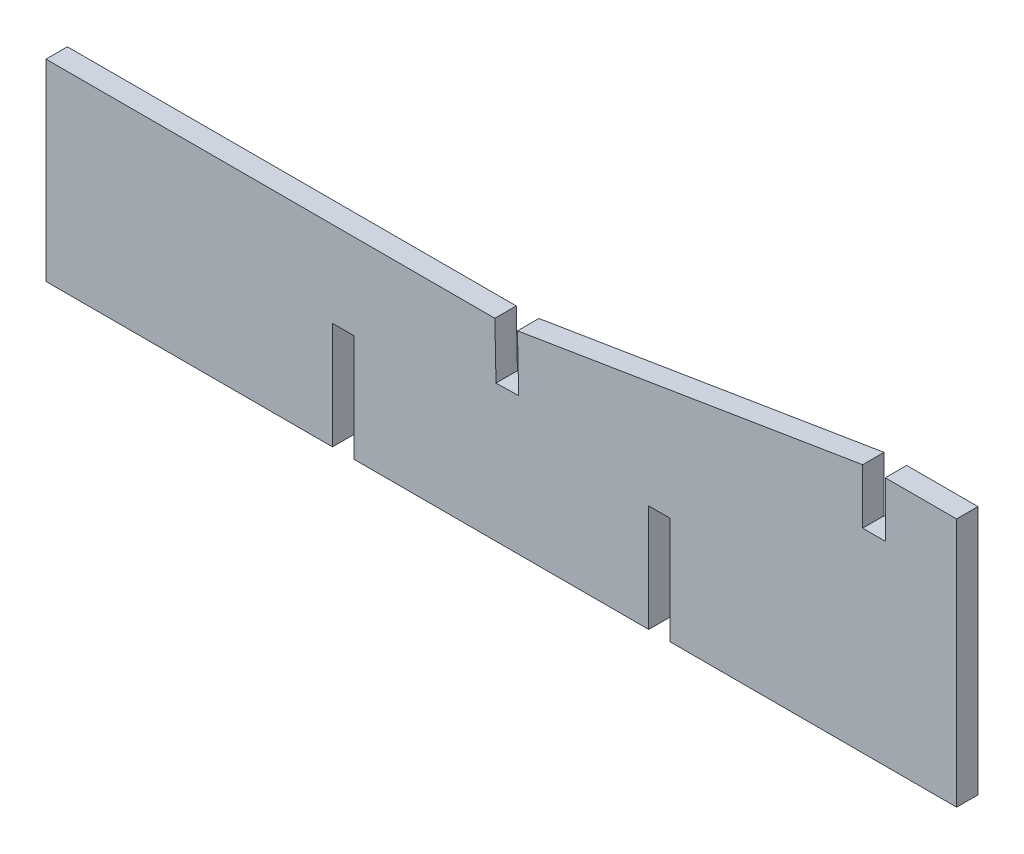
from build123d import *

# Parameters (mm, degrees)
BOSS_EXTRUDE1_DEPTH = 3


with BuildPart() as part:
    # Sketch1 → Boss-Extrude1 (new body)
    with BuildSketch(Plane.XY.offset(-573)):
        Polygon((371.221, 43.742761671), (374.396, 43.742761671), (374.396, 51.45098076), (384.396, 51.45098076), (384.396, 16.438825445), (344.221, 16.438825445), (344.221, 31.443621916), (341.221, 31.443621916), (341.221, 16.438825445), (299.875, 16.438825445), (299.875, 31.443621916), (296.875, 31.443621916), (296.875, 16.438825445), (256.7, 16.438825445), (256.7, 43.443621916), (319.643036314, 43.443621916), (319.80460348, 35.648311515), (322.978935298, 35.713515129), (322.817368061, 43.508828946), (371.221, 51.450981405), align=None)
    extrude(amount=BOSS_EXTRUDE1_DEPTH)


solid = part.part
